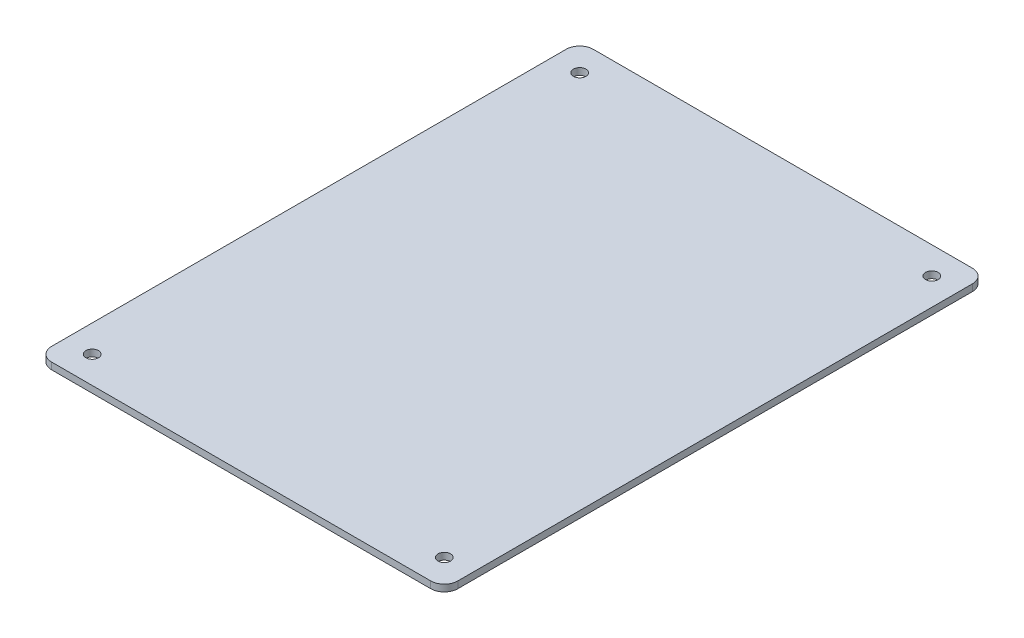
from build123d import *

# Parameters (mm, degrees)
SKETCH1_W                 = 95.25
SKETCH1_H                 = 127
BOSS_EXTRUDE1_DEPTH       = 1.5875
F_4_CLEARANCE_HOLE1_D     = 2.9464
F_4_CLEARANCE_HOLE1_DEPTH = 9.652
F_4_CLEARANCE_HOLE1_TIP   = 0.885187864
FILLET1_R                 = 3.175


with BuildPart() as part:
    # Sketch1 → Boss-Extrude1 (new body)
    with BuildSketch(Plane(origin=(0, 0, 0), x_dir=(1, 0, 0), z_dir=(0, 1, 0))):
        Rectangle(SKETCH1_W, SKETCH1_H)
    extrude(amount=BOSS_EXTRUDE1_DEPTH)

    # #4 Clearance Hole1
    with Locations(Plane(origin=(0, 1.5875, 0), x_dir=(-1, 0, 0), z_dir=(0, 1, 0))):
        with Locations((41.275, -57.15), (-41.275, -57.15), (-41.275, 57.15), (41.275, 57.15)):
            Hole(F_4_CLEARANCE_HOLE1_D / 2, depth=F_4_CLEARANCE_HOLE1_DEPTH)
            with Locations((0, 0, -(F_4_CLEARANCE_HOLE1_DEPTH + F_4_CLEARANCE_HOLE1_TIP / 2))):  # 118° drill point
                Cone(0, F_4_CLEARANCE_HOLE1_D / 2, F_4_CLEARANCE_HOLE1_TIP, mode=Mode.SUBTRACT)

    # Fillet1
    fillet1_edges = [part.edges().sort_by_distance(p)[0] for p in [
        (47.625, 0.79375, 63.5),
        (-47.625, 0.79375, 63.5),
        (-47.625, 0.79375, -63.5),
        (47.625, 0.79375, -63.5),
    ]]
    fillet(fillet1_edges, radius=FILLET1_R)


solid = part.part
